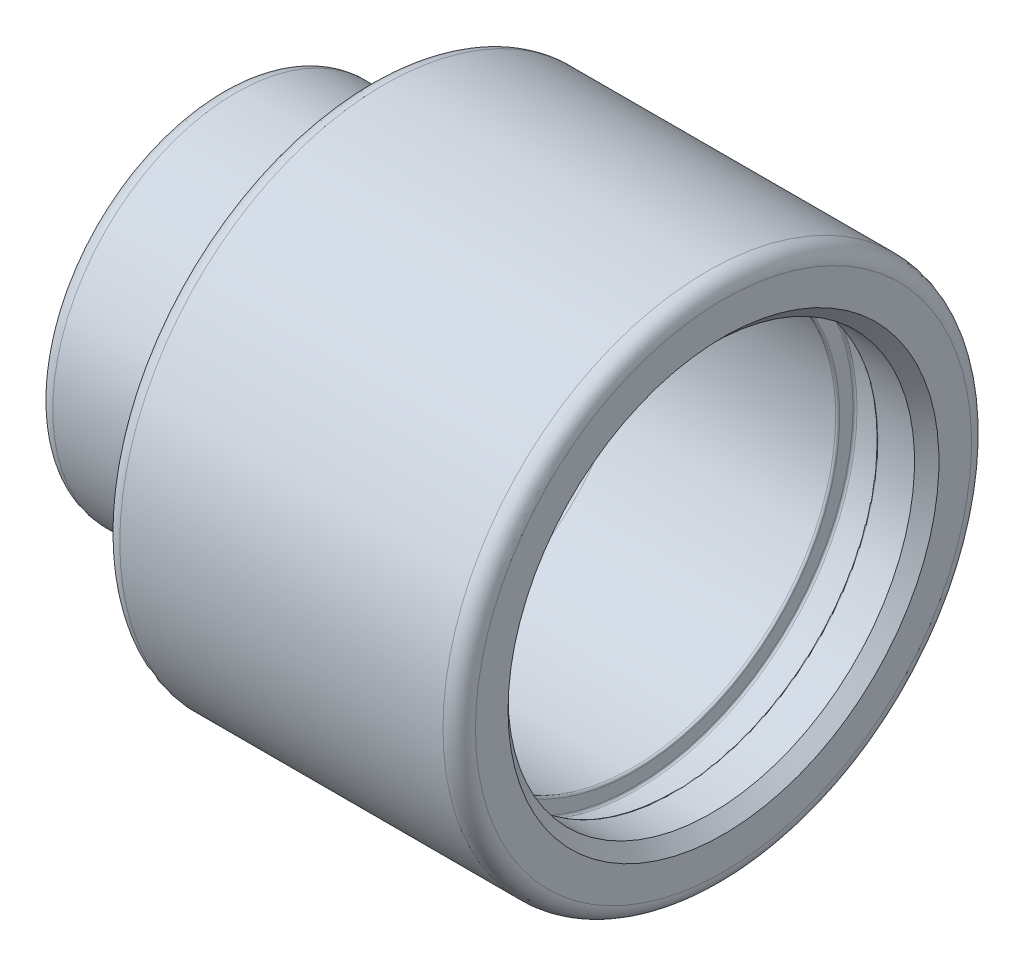
from build123d import *

# Parameters (mm, degrees)
CHAMFER1_SIZE = 0.762
FILLET1_R     = 1.016
FILLET2_R     = 1.524
FILLET3_R     = 0.762
FILLET4_R     = 0.127


with BuildPart() as part:
    # Sketch1 → Revolve1 (revolve)
    with BuildSketch(Plane.XY, mode=Mode.PRIVATE) as revolve1_sk:
        Polygon((-27.689733593, 7.62), (-24.514733593, 7.62), (-24.514733593, 8.763), (-22.127133593, 8.763), (-22.127133593, 7.62), (-15.243733593, 7.62), (-15.243733593, 12.7), (-1.756333593, 12.7), (-1.756333593, 13.7795), (0.631266407, 13.7795), (0.631266407, 12.7), (3.806266407, 12.7), (3.806266407, 16.51), (-18.418733593, 16.51), (-18.418733593, 11.43), (-27.689733593, 11.43), align=None)
    revolve(revolve1_sk.sketch.rotate(Axis((-425.207935607, 0, 0), (1, 0, 0)), 90), axis=Axis((-425.207935607, 0, 0), (1, 0, 0)))

    # Chamfer1
    chamfer1_edges = [part.edges().sort_by_distance(p)[0] for p in [
        (3.806266407, 0, -12.7),
        (-27.689733593, 0, -7.62),
    ]]
    chamfer(chamfer1_edges, length=CHAMFER1_SIZE)

    # Fillet1
    fillet1_edges = [part.edges().sort_by_distance(p)[0] for p in [
        (-27.689733593, 0, -11.43),
        (-18.418733593, 0, -11.43),
        (-18.418733593, 0, -16.51),
        (3.806266407, 0, -16.51),
    ]]
    fillet(fillet1_edges, radius=FILLET1_R)

    # Fillet2
    fillet2_edges = [part.edges().sort_by_distance(p)[0] for p in [
        (-15.243733593, 0, -7.62),
    ]]
    fillet(fillet2_edges, radius=FILLET2_R)

    # Fillet3
    fillet3_edges = [part.edges().sort_by_distance(p)[0] for p in [
        (-15.243733593, 0, -12.7),
    ]]
    fillet(fillet3_edges, radius=FILLET3_R)

    # Fillet4
    fillet4_edges = [part.edges().sort_by_distance(p)[0] for p in [
        (0.631266407, 0, -12.7),
        (0.631266407, 0, -13.7795),
        (-1.756333593, 0, -13.7795),
        (-1.756333593, 0, -12.7),
        (-22.127133593, 0, -7.62),
        (-22.127133593, 0, -8.763),
        (-24.514733593, 0, -8.763),
        (-24.514733593, 0, -7.62),
    ]]
    fillet(fillet4_edges, radius=FILLET4_R)


solid = part.part
